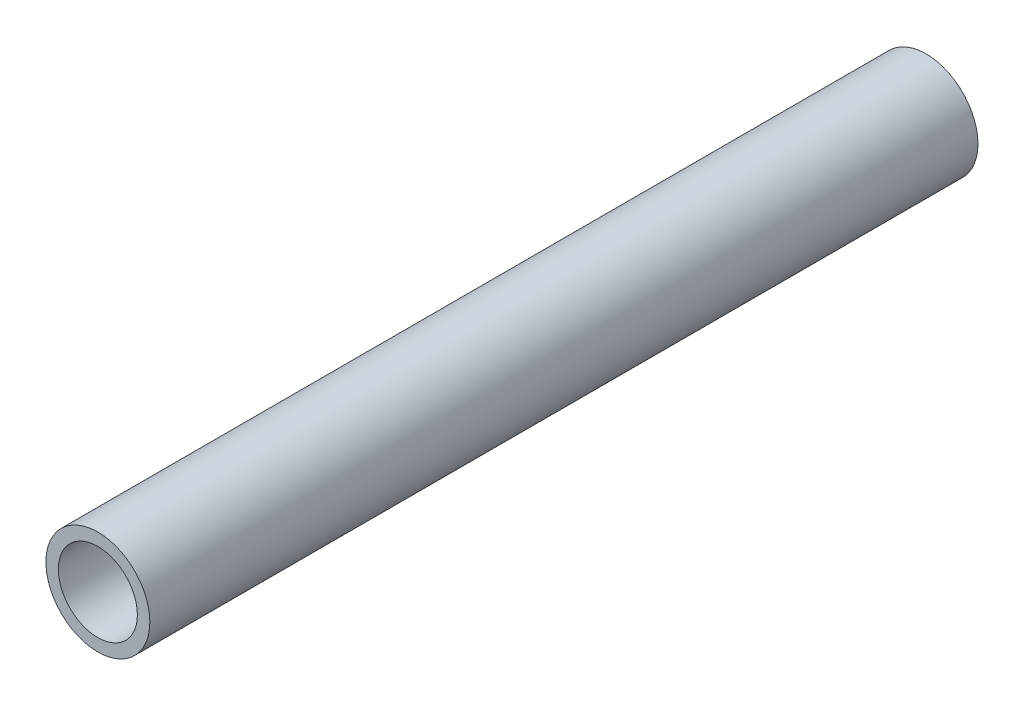
from build123d import *

# Parameters (mm, degrees)
SKETCH1_R           = 16.7005
SKETCH1_R_2         = 12.7
EXTRUDE_THIN1_DEPTH = 266.192


with BuildPart() as part:
    # Sketch1 → Extrude-Thin1 (new body)
    with BuildSketch(Plane.XY):
        Circle(SKETCH1_R)
        Circle(SKETCH1_R_2, mode=Mode.SUBTRACT)
    extrude(amount=EXTRUDE_THIN1_DEPTH)


solid = part.part
